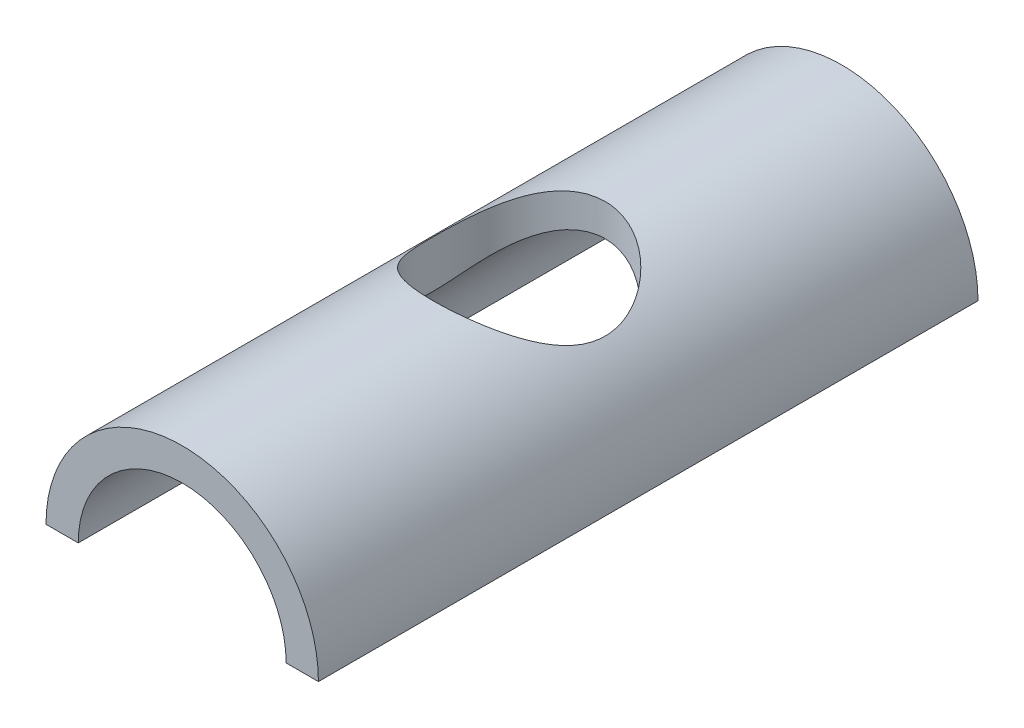
from build123d import *

# Parameters (mm, degrees)
EXTRUDE_1_DEPTH     = 46
SKETCH_2_R          = 6
CUT_EXTRUDE_1_DEPTH = 45


with BuildPart() as part:
    # ｽｹｯﾁ1 → ﾎﾞｽ - 押し出し1 (new body)
    with BuildSketch(Plane.XY):
        with BuildLine():
            Line((-9.5, 0), (-7.25, 0))
            ThreePointArc((-7.25, 0), (0, 7.25), (7.25, 0))
            Line((7.25, 0), (9.5, 0))
            ThreePointArc((9.5, 0), (0, 9.5), (-9.5, 0))
        make_face()
    extrude(amount=EXTRUDE_1_DEPTH)

    # ｽｹｯﾁ2 → ｶｯﾄ - 押し出し1 (cut)
    with BuildSketch(Plane(origin=(0, 0, 0), x_dir=(1, 0, 0), z_dir=(0, 1, 0))):
        with Locations(Location((0, -22.5, 0), (0, 0, 90))):
            Circle(SKETCH_2_R)
    extrude(amount=CUT_EXTRUDE_1_DEPTH, mode=Mode.SUBTRACT)


solid = part.part
